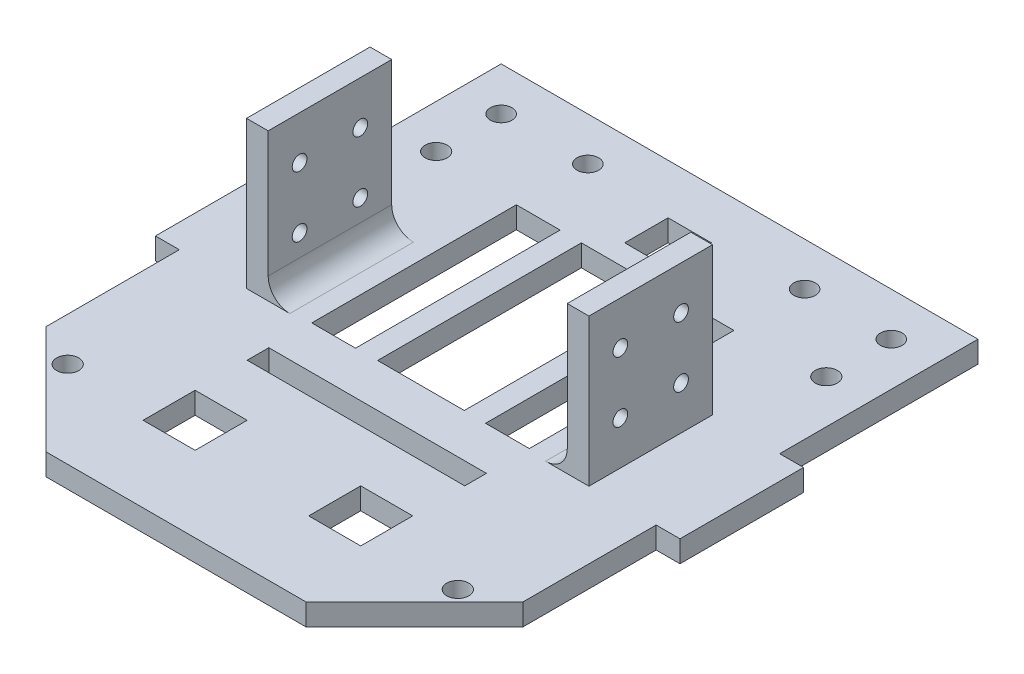
from build123d import *

# Parameters (mm, degrees)
SKETCH1_W           = 20
SKETCH1_H           = 47
BOSS_EXTRUDE3_DEPTH = 5
SKETCH2_W           = 10.1
SKETCH2_H           = 47.2
SKETCH2_W_2         = 50.2
SKETCH2_H_2         = 5
CUT_EXTRUDE1_DEPTH  = 15
SKETCH3_R           = 2.55
CUT_EXTRUDE3_DEPTH  = 10
SKETCH4_W           = 5
SKETCH4_H           = 28.5
BOSS_EXTRUDE4_DEPTH = 34
CUT_EXTRUDE4_DEPTH  = 130.812364588
FILLET1_R           = 5
SKETCH6_W           = 5.5
SKETCH6_H           = 28.5
BOSS_EXTRUDE5_DEPTH = 5
SKETCH9_R           = 2.5
CUT_EXTRUDE7_DEPTH  = 180
CHAMFER1_SIZE       = 25
SKETCH10_W          = 10
SKETCH10_H          = 10
SKETCH10_W_2        = 12
SKETCH10_H_2        = 12
CUT_EXTRUDE8_DEPTH  = 106.906798649


with BuildPart() as part:
    # Sketch1 → Boss-Extrude3 (new body)
    with BuildSketch(Plane(origin=(0, 0, 0), x_dir=(1, 0, 0), z_dir=(0, 1, 0))):
        Polygon((55, 50), (-55, 50), (-55, 21.75), (-55, -21.75), (-55, -80), (-20, -80), (2.5, -80), (20, -80), (42.5, -80), (55, -80), (55, -21.75), (55, 21.75), align=None)
        Rectangle(SKETCH1_W, SKETCH1_H, mode=Mode.SUBTRACT)
    extrude(amount=BOSS_EXTRUDE3_DEPTH)

    # Sketch2 → Cut-Extrude1 (cut)
    with BuildSketch(Plane.XZ):
        with Locations((-20.05, 0)):
            Rectangle(SKETCH2_W, SKETCH2_H)
        with Locations((20.05, 0)):
            Rectangle(SKETCH2_W, SKETCH2_H)
        with Locations((0, 36)):
            Rectangle(SKETCH2_W_2, SKETCH2_H_2)
    extrude(amount=-CUT_EXTRUDE1_DEPTH, mode=Mode.SUBTRACT)

    # Sketch3 → Cut-Extrude3 (cut)
    with BuildSketch(Plane(origin=(0, 5, 0), x_dir=(1, 0, 0), z_dir=(0, 1, 0))):
        with Locations(Location((-45, 25, 0), (0, 0, 270))):
            Circle(SKETCH3_R)
        with Locations(Location((-45, -60, 0), (0, 0, 270))):
            Circle(SKETCH3_R)
        with Locations(Location((45, -60, 0), (0, 0, 270))):
            Circle(SKETCH3_R)
        with Locations(Location((45, 25, 0), (0, 0, 270))):
            Circle(SKETCH3_R)
    extrude(amount=-CUT_EXTRUDE3_DEPTH, mode=Mode.SUBTRACT)

    # Sketch4 → Boss-Extrude4 (add)
    with BuildSketch(Plane(origin=(0, 5, 0), x_dir=(1, 0, 0), z_dir=(0, 1, 0))):
        with Locations((-37, -10)):
            Rectangle(SKETCH4_W, SKETCH4_H)
        with Locations((37, -10)):
            Rectangle(SKETCH4_W, SKETCH4_H)
    extrude(amount=BOSS_EXTRUDE4_DEPTH)

    # Sketch5 → Cut-Extrude4 (cut, through all)
    with BuildSketch(Plane.ZY.offset(39.5)):
        with BuildLine():
            ThreePointArc((4.7, 15), (4.202081528, 16.202081528), (3, 16.7))
            Line((3, 16.7), (3, 15))
            Line((3, 15), (4.7, 15))
        make_face()
        with BuildLine():
            Line((3, 15), (3, 16.7))
            ThreePointArc((3, 16.7), (1.797918472, 13.797918472), (4.7, 15))
            Line((4.7, 15), (3, 15))
        make_face()
        with BuildLine():
            Line((3, 27.3), (3, 29))
            Line((3, 29), (4.7, 29))
            ThreePointArc((4.7, 29), (1.797918472, 30.202081528), (3, 27.3))
        make_face()
        with BuildLine():
            Line((4.7, 29), (3, 29))
            Line((3, 29), (3, 27.3))
            ThreePointArc((3, 27.3), (4.202081528, 27.797918472), (4.7, 29))
        make_face()
        with BuildLine():
            ThreePointArc((18.7, 29), (17, 30.7), (15.3, 29))
            Line((15.3, 29), (17, 29))
            Line((17, 29), (17, 27.3))
            ThreePointArc((17, 27.3), (18.202081528, 27.797918472), (18.7, 29))
        make_face()
        with BuildLine():
            Line((17, 29), (15.3, 29))
            ThreePointArc((15.3, 29), (15.797918472, 27.797918472), (17, 27.3))
            Line((17, 27.3), (17, 29))
        make_face()
        with BuildLine():
            ThreePointArc((18.7, 15), (18.202081528, 16.202081528), (17, 16.7))
            Line((17, 16.7), (17, 15))
            Line((17, 15), (15.3, 15))
            ThreePointArc((15.3, 15), (17, 13.3), (18.7, 15))
        make_face()
        with BuildLine():
            Line((17, 15), (17, 16.7))
            ThreePointArc((17, 16.7), (15.797918472, 16.202081528), (15.3, 15))
            Line((15.3, 15), (17, 15))
        make_face()
    extrude(amount=-CUT_EXTRUDE4_DEPTH, mode=Mode.SUBTRACT)

    # Fillet1
    fillet1_edges = [part.edges().sort_by_distance(p)[0] for p in [
        (-34.5, 5, 10),
        (34.5, 5, 10),
    ]]
    fillet(fillet1_edges, radius=FILLET1_R)

    # Sketch6 → Boss-Extrude5 (add)
    with BuildSketch(Plane(origin=(0, 5, 0), x_dir=(1, 0, 0), z_dir=(0, 1, 0))):
        with Locations((-57.75, -10)):
            Rectangle(SKETCH6_W, SKETCH6_H)
        with Locations((57.75, -10)):
            Rectangle(SKETCH6_W, SKETCH6_H)
    extrude(amount=-BOSS_EXTRUDE5_DEPTH)

    # Sketch9 → Cut-Extrude7 (cut)
    with BuildSketch(Plane(origin=(0, 5, 0), x_dir=(1, 0, 0), z_dir=(0, 1, 0))):
        with Locations(Location((-45, 40, 0), (0, 0, 270))):
            Circle(SKETCH9_R)
        with Locations(Location((45, 40, 0), (0, 0, 270))):
            Circle(SKETCH9_R)
        with Locations(Location((-25, 40, 0), (0, 0, 270))):
            Circle(SKETCH9_R)
        with Locations(Location((25, 40, 0), (0, 0, 270))):
            Circle(SKETCH9_R)
    extrude(amount=-CUT_EXTRUDE7_DEPTH, mode=Mode.SUBTRACT)

    # Chamfer1
    chamfer1_edges = [part.edges().sort_by_distance(p)[0] for p in [
        (55, 2.5, 80),
        (-55, 2.5, 80),
    ]]
    chamfer(chamfer1_edges, length=CHAMFER1_SIZE)

    # Sketch10 → Cut-Extrude8 (cut, through all)
    with BuildSketch(Plane(origin=(0, 5, 0), x_dir=(1, 0, 0), z_dir=(0, 1, 0))):
        with Locations((0, 33.5)):
            Rectangle(SKETCH10_W, SKETCH10_H)
        with Locations((-19.1, -56.5)):
            Rectangle(SKETCH10_W_2, SKETCH10_H_2)
        with Locations((19.1, -56.5)):
            Rectangle(SKETCH10_W_2, SKETCH10_H_2)
    extrude(amount=-CUT_EXTRUDE8_DEPTH, mode=Mode.SUBTRACT)


solid = part.part
